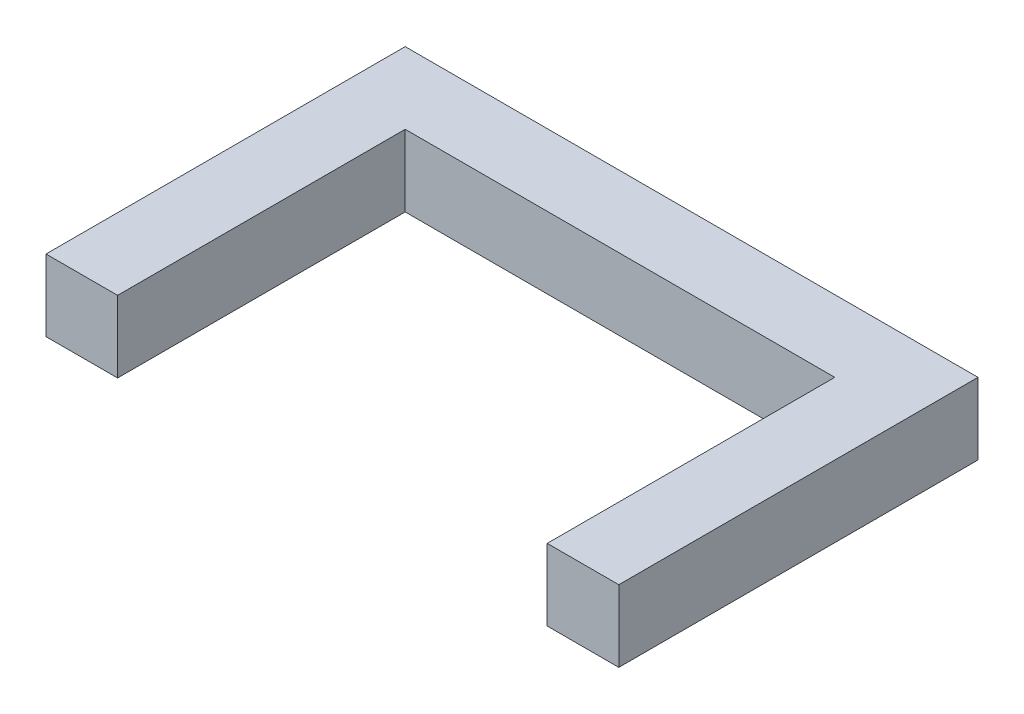
from build123d import *

# Parameters (mm, degrees)
BOSS_EXTRUDE1_DEPTH = 4


with BuildPart() as part:
    # Sketch1 → Boss-Extrude1 (new body)
    with BuildSketch(Plane(origin=(0, 0, 0), x_dir=(1, 0, 0), z_dir=(0, 1, 0))):
        Polygon((0, 0), (0, 20.066), (32, 20.066), (32, 0), (28, 0), (28, 16.066), (4, 16.066), (4, 0), align=None)
    extrude(amount=BOSS_EXTRUDE1_DEPTH)


solid = part.part
